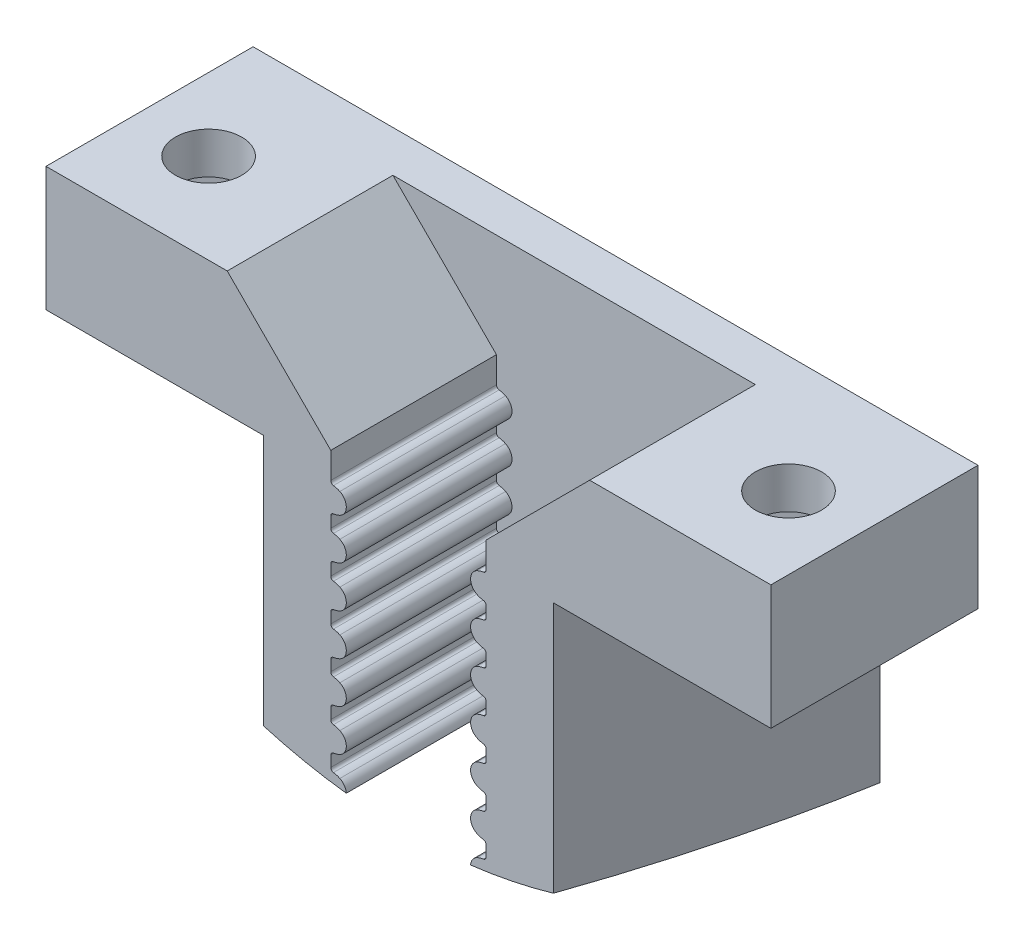
from build123d import *

# Parameters (mm, degrees)
SKETCH1_W            = 35
SKETCH1_H            = 6
BOSS_EXTRUDE1_DEPTH  = 10
BOSS_EXTRUDE2_DEPTH  = 10
SKETCH4_W            = 6
SKETCH4_H            = 13.146428929
CUT_EXTRUDE1_DEPTH   = 8
CUT_EXTRUDE2_DEPTH   = 8
LPATTERN2_COUNT      = 10
LPATTERN2_PITCH      = 2
MIRROR1_COPY_1_DEPTH = 8
MIRROR1_COPY_2_DEPTH = 8
MIRROR1_COPY_3_DEPTH = 8
MIRROR1_COPY_4_DEPTH = 8
MIRROR1_COPY_5_DEPTH = 8
MIRROR1_COPY_6_DEPTH = 8
MIRROR1_COPY_7_DEPTH = 8
MIRROR1_COPY_8_DEPTH = 8
MIRROR1_COPY_9_DEPTH = 8
CUT_EXTRUDE3_DEPTH   = 25.064051894
SKETCH7_W            = 35
SKETCH7_H            = 10
BOSS_EXTRUDE3_DEPTH  = 6
SKETCH8_W            = 7.5
SKETCH8_H            = 6
CUT_EXTRUDE4_DEPTH   = 8
CUT_EXTRUDE5_DEPTH   = 4
SKETCH10_R           = 1.6
CUT_EXTRUDE6_DEPTH   = 27.462237717
CHAMFER1_SIZE        = 5


with BuildPart() as part:
    # Sketch1 → Boss-Extrude1 (new body)
    with BuildSketch(Plane.XY):
        Rectangle(SKETCH1_W, SKETCH1_H)
    extrude(amount=BOSS_EXTRUDE1_DEPTH)

    # Sketch2 → Boss-Extrude2 (add)
    with BuildSketch(Plane.XY.offset(10)):
        with BuildLine():
            Line((-17.5, -3), (17.5, -3))
            ThreePointArc((17.5, -3), (0, -10.146428929), (-17.5, -3))
        make_face()
    extrude(amount=-BOSS_EXTRUDE2_DEPTH)

    # Sketch4 → Cut-Extrude1 (cut)
    with BuildSketch(Plane.XY.offset(10)):
        with Locations((0, -3.573214465)):
            Rectangle(SKETCH4_W, SKETCH4_H)
    extrude(amount=-CUT_EXTRUDE1_DEPTH, mode=Mode.SUBTRACT)

    # Sketch5 → Cut-Extrude2 (cut)
    with BuildSketch(Plane.XY.offset(10)):
        with BuildLine():
            Line((3, 2), (3, 4))
            ThreePointArc((3, 4), (3.084360941, 3.705850588), (3.311797753, 3.501123596))
            ThreePointArc((3.311797753, 3.501123596), (3.461937846, 3.442388286), (3.619565217, 3.408543109))
            ThreePointArc((3.619565217, 3.408543109), (3.712771412, 3.358731646), (3.75, 3.259824575))
            Line((3.75, 3.259824575), (3.75, 2.740175425))
            ThreePointArc((3.75, 2.740175425), (3.712771412, 2.641268354), (3.619565217, 2.591456891))
            ThreePointArc((3.619565217, 2.591456891), (3.461937846, 2.557611714), (3.311797753, 2.498876404))
            ThreePointArc((3.311797753, 2.498876404), (3.084360941, 2.294149412), (3, 2))
        make_face()
    cut_extrude2 = extrude(amount=-CUT_EXTRUDE2_DEPTH, mode=Mode.SUBTRACT)

    # LPattern2: Cut-Extrude2 ×10
    with Locations(*[(0, -i * LPATTERN2_PITCH, 0) for i in range(1, LPATTERN2_COUNT)]):
        add(cut_extrude2, mode=Mode.SUBTRACT)

    # Mirror1: Cut-Extrude2 across plane
    add(cut_extrude2.mirror(Plane(origin=(0, 0, 0), x_dir=(0, 0, 1), z_dir=(1, 0, 0))), mode=Mode.SUBTRACT)

    # Mirror1 copy 1 sketch → Mirror1 copy 1 (cut)
    with BuildSketch(Plane(origin=(0, -2, 10), x_dir=(-1, 0, 0), z_dir=(0, 0, 1))):
        with BuildLine():
            Line((3, -2), (3, -4))
            ThreePointArc((3, -4), (3.084360941, -3.705850588), (3.311797753, -3.501123596))
            ThreePointArc((3.311797753, -3.501123596), (3.461937846, -3.442388286), (3.619565217, -3.408543109))
            ThreePointArc((3.619565217, -3.408543109), (3.712771412, -3.358731646), (3.75, -3.259824575))
            Line((3.75, -3.259824575), (3.75, -2.740175425))
            ThreePointArc((3.75, -2.740175425), (3.712771412, -2.641268354), (3.619565217, -2.591456891))
            ThreePointArc((3.619565217, -2.591456891), (3.461937846, -2.557611714), (3.311797753, -2.498876404))
            ThreePointArc((3.311797753, -2.498876404), (3.084360941, -2.294149412), (3, -2))
        make_face()
    extrude(amount=-MIRROR1_COPY_1_DEPTH, mode=Mode.SUBTRACT)

    # Mirror1 copy 2 sketch → Mirror1 copy 2 (cut)
    with BuildSketch(Plane(origin=(0, -4, 10), x_dir=(-1, 0, 0), z_dir=(0, 0, 1))):
        with BuildLine():
            Line((3, -2), (3, -4))
            ThreePointArc((3, -4), (3.084360941, -3.705850588), (3.311797753, -3.501123596))
            ThreePointArc((3.311797753, -3.501123596), (3.461937846, -3.442388286), (3.619565217, -3.408543109))
            ThreePointArc((3.619565217, -3.408543109), (3.712771412, -3.358731646), (3.75, -3.259824575))
            Line((3.75, -3.259824575), (3.75, -2.740175425))
            ThreePointArc((3.75, -2.740175425), (3.712771412, -2.641268354), (3.619565217, -2.591456891))
            ThreePointArc((3.619565217, -2.591456891), (3.461937846, -2.557611714), (3.311797753, -2.498876404))
            ThreePointArc((3.311797753, -2.498876404), (3.084360941, -2.294149412), (3, -2))
        make_face()
    extrude(amount=-MIRROR1_COPY_2_DEPTH, mode=Mode.SUBTRACT)

    # Mirror1 copy 3 sketch → Mirror1 copy 3 (cut)
    with BuildSketch(Plane(origin=(0, -6, 10), x_dir=(-1, 0, 0), z_dir=(0, 0, 1))):
        with BuildLine():
            Line((3, -2), (3, -4))
            ThreePointArc((3, -4), (3.084360941, -3.705850588), (3.311797753, -3.501123596))
            ThreePointArc((3.311797753, -3.501123596), (3.461937846, -3.442388286), (3.619565217, -3.408543109))
            ThreePointArc((3.619565217, -3.408543109), (3.712771412, -3.358731646), (3.75, -3.259824575))
            Line((3.75, -3.259824575), (3.75, -2.740175425))
            ThreePointArc((3.75, -2.740175425), (3.712771412, -2.641268354), (3.619565217, -2.591456891))
            ThreePointArc((3.619565217, -2.591456891), (3.461937846, -2.557611714), (3.311797753, -2.498876404))
            ThreePointArc((3.311797753, -2.498876404), (3.084360941, -2.294149412), (3, -2))
        make_face()
    extrude(amount=-MIRROR1_COPY_3_DEPTH, mode=Mode.SUBTRACT)

    # Mirror1 copy 4 sketch → Mirror1 copy 4 (cut)
    with BuildSketch(Plane(origin=(0, -8, 10), x_dir=(-1, 0, 0), z_dir=(0, 0, 1))):
        with BuildLine():
            Line((3, -2), (3, -4))
            ThreePointArc((3, -4), (3.084360941, -3.705850588), (3.311797753, -3.501123596))
            ThreePointArc((3.311797753, -3.501123596), (3.461937846, -3.442388286), (3.619565217, -3.408543109))
            ThreePointArc((3.619565217, -3.408543109), (3.712771412, -3.358731646), (3.75, -3.259824575))
            Line((3.75, -3.259824575), (3.75, -2.740175425))
            ThreePointArc((3.75, -2.740175425), (3.712771412, -2.641268354), (3.619565217, -2.591456891))
            ThreePointArc((3.619565217, -2.591456891), (3.461937846, -2.557611714), (3.311797753, -2.498876404))
            ThreePointArc((3.311797753, -2.498876404), (3.084360941, -2.294149412), (3, -2))
        make_face()
    extrude(amount=-MIRROR1_COPY_4_DEPTH, mode=Mode.SUBTRACT)

    # Mirror1 copy 5 sketch → Mirror1 copy 5 (cut)
    with BuildSketch(Plane(origin=(0, -10, 10), x_dir=(-1, 0, 0), z_dir=(0, 0, 1))):
        with BuildLine():
            Line((3, -2), (3, -4))
            ThreePointArc((3, -4), (3.084360941, -3.705850588), (3.311797753, -3.501123596))
            ThreePointArc((3.311797753, -3.501123596), (3.461937846, -3.442388286), (3.619565217, -3.408543109))
            ThreePointArc((3.619565217, -3.408543109), (3.712771412, -3.358731646), (3.75, -3.259824575))
            Line((3.75, -3.259824575), (3.75, -2.740175425))
            ThreePointArc((3.75, -2.740175425), (3.712771412, -2.641268354), (3.619565217, -2.591456891))
            ThreePointArc((3.619565217, -2.591456891), (3.461937846, -2.557611714), (3.311797753, -2.498876404))
            ThreePointArc((3.311797753, -2.498876404), (3.084360941, -2.294149412), (3, -2))
        make_face()
    extrude(amount=-MIRROR1_COPY_5_DEPTH, mode=Mode.SUBTRACT)

    # Mirror1 copy 6 sketch → Mirror1 copy 6 (cut)
    with BuildSketch(Plane(origin=(0, -12, 10), x_dir=(-1, 0, 0), z_dir=(0, 0, 1))):
        with BuildLine():
            Line((3, -2), (3, -4))
            ThreePointArc((3, -4), (3.084360941, -3.705850588), (3.311797753, -3.501123596))
            ThreePointArc((3.311797753, -3.501123596), (3.461937846, -3.442388286), (3.619565217, -3.408543109))
            ThreePointArc((3.619565217, -3.408543109), (3.712771412, -3.358731646), (3.75, -3.259824575))
            Line((3.75, -3.259824575), (3.75, -2.740175425))
            ThreePointArc((3.75, -2.740175425), (3.712771412, -2.641268354), (3.619565217, -2.591456891))
            ThreePointArc((3.619565217, -2.591456891), (3.461937846, -2.557611714), (3.311797753, -2.498876404))
            ThreePointArc((3.311797753, -2.498876404), (3.084360941, -2.294149412), (3, -2))
        make_face()
    extrude(amount=-MIRROR1_COPY_6_DEPTH, mode=Mode.SUBTRACT)

    # Mirror1 copy 7 sketch → Mirror1 copy 7 (cut)
    with BuildSketch(Plane(origin=(0, -14, 10), x_dir=(-1, 0, 0), z_dir=(0, 0, 1))):
        with BuildLine():
            Line((3, -2), (3, -4))
            ThreePointArc((3, -4), (3.084360941, -3.705850588), (3.311797753, -3.501123596))
            ThreePointArc((3.311797753, -3.501123596), (3.461937846, -3.442388286), (3.619565217, -3.408543109))
            ThreePointArc((3.619565217, -3.408543109), (3.712771412, -3.358731646), (3.75, -3.259824575))
            Line((3.75, -3.259824575), (3.75, -2.740175425))
            ThreePointArc((3.75, -2.740175425), (3.712771412, -2.641268354), (3.619565217, -2.591456891))
            ThreePointArc((3.619565217, -2.591456891), (3.461937846, -2.557611714), (3.311797753, -2.498876404))
            ThreePointArc((3.311797753, -2.498876404), (3.084360941, -2.294149412), (3, -2))
        make_face()
    extrude(amount=-MIRROR1_COPY_7_DEPTH, mode=Mode.SUBTRACT)

    # Mirror1 copy 8 sketch → Mirror1 copy 8 (cut)
    with BuildSketch(Plane(origin=(0, -16, 10), x_dir=(-1, 0, 0), z_dir=(0, 0, 1))):
        with BuildLine():
            Line((3, -2), (3, -4))
            ThreePointArc((3, -4), (3.084360941, -3.705850588), (3.311797753, -3.501123596))
            ThreePointArc((3.311797753, -3.501123596), (3.461937846, -3.442388286), (3.619565217, -3.408543109))
            ThreePointArc((3.619565217, -3.408543109), (3.712771412, -3.358731646), (3.75, -3.259824575))
            Line((3.75, -3.259824575), (3.75, -2.740175425))
            ThreePointArc((3.75, -2.740175425), (3.712771412, -2.641268354), (3.619565217, -2.591456891))
            ThreePointArc((3.619565217, -2.591456891), (3.461937846, -2.557611714), (3.311797753, -2.498876404))
            ThreePointArc((3.311797753, -2.498876404), (3.084360941, -2.294149412), (3, -2))
        make_face()
    extrude(amount=-MIRROR1_COPY_8_DEPTH, mode=Mode.SUBTRACT)

    # Mirror1 copy 9 sketch → Mirror1 copy 9 (cut)
    with BuildSketch(Plane(origin=(0, -18, 10), x_dir=(-1, 0, 0), z_dir=(0, 0, 1))):
        with BuildLine():
            Line((3, -2), (3, -4))
            ThreePointArc((3, -4), (3.084360941, -3.705850588), (3.311797753, -3.501123596))
            ThreePointArc((3.311797753, -3.501123596), (3.461937846, -3.442388286), (3.619565217, -3.408543109))
            ThreePointArc((3.619565217, -3.408543109), (3.712771412, -3.358731646), (3.75, -3.259824575))
            Line((3.75, -3.259824575), (3.75, -2.740175425))
            ThreePointArc((3.75, -2.740175425), (3.712771412, -2.641268354), (3.619565217, -2.591456891))
            ThreePointArc((3.619565217, -2.591456891), (3.461937846, -2.557611714), (3.311797753, -2.498876404))
            ThreePointArc((3.311797753, -2.498876404), (3.084360941, -2.294149412), (3, -2))
        make_face()
    extrude(amount=-MIRROR1_COPY_9_DEPTH, mode=Mode.SUBTRACT)

    # Sketch6 → Cut-Extrude3 (cut, through all)
    with BuildSketch(Plane(origin=(0, 3, 0), x_dir=(1, 0, 0), z_dir=(0, 1, 0))):
        Polygon((-17.5, 0), (-12.773502692, 0), (-7, -10), (-17.5, -10), align=None)
    cut_extrude3 = extrude(amount=-CUT_EXTRUDE3_DEPTH, mode=Mode.SUBTRACT)

    # Mirror2: Cut-Extrude3 across plane
    add(cut_extrude3.mirror(Plane(origin=(0, 0, 0), x_dir=(0, 0, 1), z_dir=(1, 0, 0))), mode=Mode.SUBTRACT)

    # Sketch7 → Boss-Extrude3 (add)
    with BuildSketch(Plane(origin=(0, 3, 0), x_dir=(1, 0, 0), z_dir=(0, 1, 0))):
        with Locations((0, -5)):
            Rectangle(SKETCH7_W, SKETCH7_H)
    extrude(amount=BOSS_EXTRUDE3_DEPTH)

    # Sketch8 → Cut-Extrude4 (cut)
    with BuildSketch(Plane.XY.offset(10)):
        with Locations((0, 6)):
            Rectangle(SKETCH8_W, SKETCH8_H)
    extrude(amount=-CUT_EXTRUDE4_DEPTH, mode=Mode.SUBTRACT)

    # Sketch9 → Cut-Extrude5 (cut)
    with BuildSketch(Plane.XZ.offset(-3)):
        Polygon((16.814582562, 4.025), (16.814582562, 7.275), (14, 8.9), (11.185417438, 7.275), (11.185417438, 4.025), (14, 2.4), align=None)
    cut_extrude5 = extrude(amount=-CUT_EXTRUDE5_DEPTH, mode=Mode.SUBTRACT)

    # Mirror3: Cut-Extrude5 across plane
    add(cut_extrude5.mirror(Plane(origin=(0, 0, 0), x_dir=(0, 0, 1), z_dir=(1, 0, 0))), mode=Mode.SUBTRACT)

    # Sketch10 → Cut-Extrude6 (cut, through all)
    with BuildSketch(Plane.XZ.offset(-7)):
        with Locations(Location((14, 5.65, 0), (0, 0, 270))):
            Circle(SKETCH10_R)
    cut_extrude6 = extrude(amount=-CUT_EXTRUDE6_DEPTH, mode=Mode.SUBTRACT)

    # Mirror4: Cut-Extrude6 across plane
    add(cut_extrude6.mirror(Plane(origin=(0, 0, 0), x_dir=(0, 0, 1), z_dir=(1, 0, 0))), mode=Mode.SUBTRACT)

    # Chamfer1
    chamfer1_edges = [part.edges().sort_by_distance(p)[0] for p in [
        (-3.75, 9, 6),
        (3.75, 9, 6),
    ]]
    chamfer(chamfer1_edges, length=CHAMFER1_SIZE)


solid = part.part
